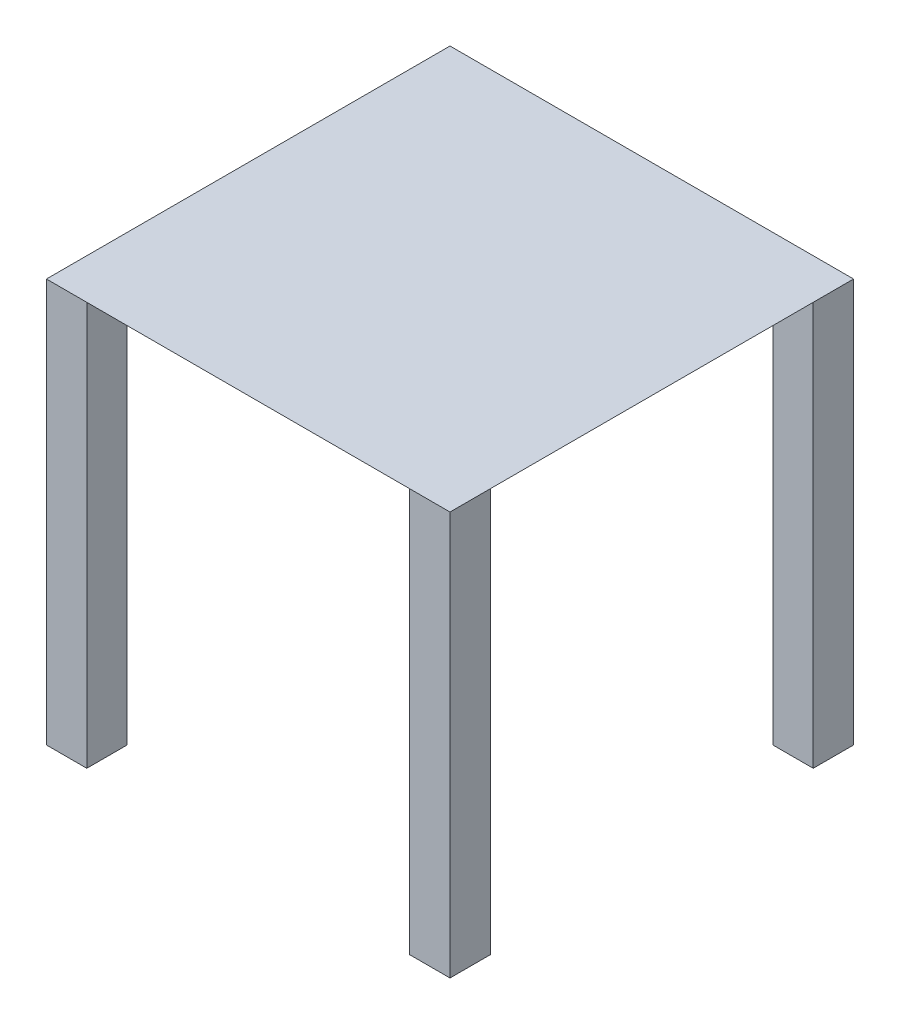
from build123d import *

# Parameters (mm, degrees)
SKETCH5_W           = 150
SKETCH5_H           = 150
CUT_EXTRUDE1_DEPTH  = 100
SKETCH6_W           = 100
SKETCH6_H           = 100
BOSS_EXTRUDE1_DEPTH = 1000


with BuildPart() as part:
    # Sketch1 → Loft1 section 0
    with BuildSketch(Plane(origin=(0, 0, 0), x_dir=(1, 0, 0), z_dir=(0, 1, 0)), mode=Mode.PRIVATE) as loft1_s0:
        with BuildLine():
            Line((-500, -500), (500, -500))
            Line((500, -500), (500, 500))
            Line((500, 500), (-500, 500))
            Line((-500, 500), (-500, -500))
        make_face()
    loft([loft1_s0.sketch, Vertex(0, -400, 0)])

    # Sketch5 → Cut-Extrude1 (cut)
    with BuildSketch(Plane(origin=(0, -400, 0), x_dir=(-1, 0, 0), z_dir=(0, -1, 0))):
        Rectangle(SKETCH5_W, SKETCH5_H)
    extrude(amount=-CUT_EXTRUDE1_DEPTH, mode=Mode.SUBTRACT)

    # Sketch6 → Boss-Extrude1 (add)
    with BuildSketch(Plane(origin=(0, 0, 0), x_dir=(1, 0, 0), z_dir=(0, 1, 0))):
        with Locations((-450, 450)):
            Rectangle(SKETCH6_W, SKETCH6_H)
        with Locations((450, 450)):
            Rectangle(SKETCH6_W, SKETCH6_H)
        with Locations((-450, -450)):
            Rectangle(SKETCH6_W, SKETCH6_H)
        with Locations((450, -450)):
            Rectangle(SKETCH6_W, SKETCH6_H)
    extrude(amount=-BOSS_EXTRUDE1_DEPTH)


solid = part.part
